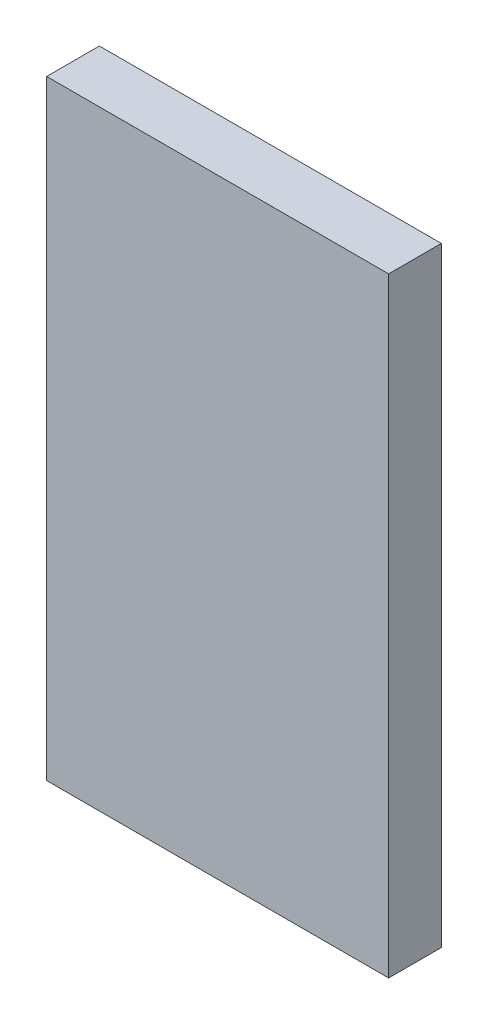
from build123d import *

# Parameters (mm, degrees)
SKETCH1_W           = 60
SKETCH1_H           = 107
BOSS_EXTRUDE1_DEPTH = 9.25


with BuildPart() as part:
    # Sketch1 → Boss-Extrude1 (new body)
    with BuildSketch(Plane.XY.offset(9.25)):
        Rectangle(SKETCH1_W, SKETCH1_H)
    extrude(amount=-BOSS_EXTRUDE1_DEPTH)


solid = part.part
